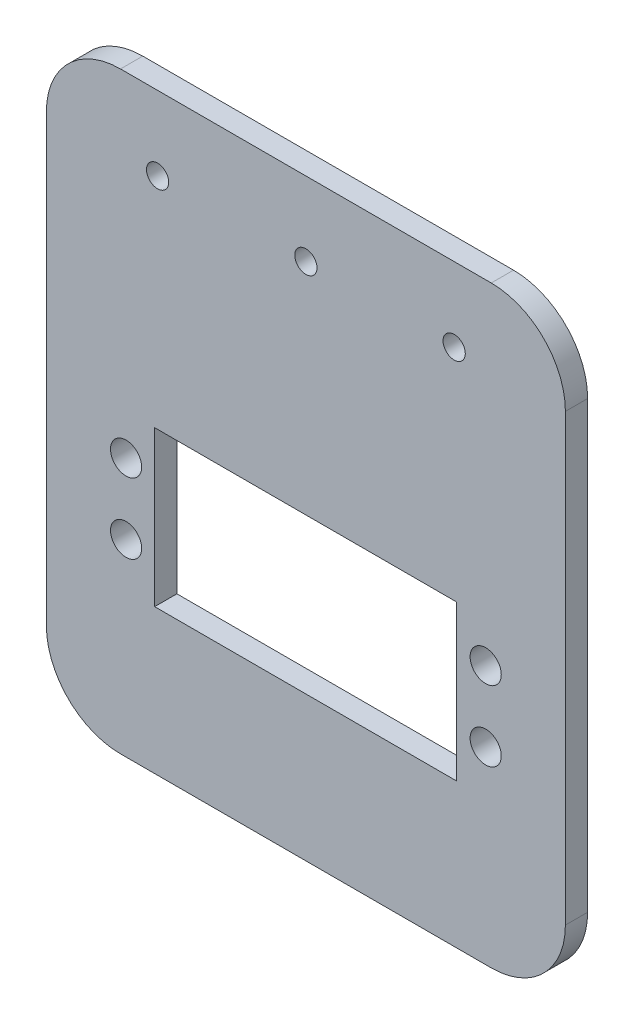
from build123d import *

# Parameters (mm, degrees)
SKETCH_1_W          = 70
SKETCH_1_H          = 80
EXTRUDE_1_DEPTH     = 3
SKETCH_4_R          = 2.1
SKETCH_4_W          = 40.676852231
SKETCH_4_H          = 20.906984827
CUT_EXTRUDE_3_DEPTH = 10
SKETCH_5_R          = 1.5
CUT_EXTRUDE_4_DEPTH = 10
FILLET_1_R          = 10


with BuildPart() as part:
    # 草图1 → 凸台-拉伸1 (new body)
    with BuildSketch(Plane.XY):
        Rectangle(SKETCH_1_W, SKETCH_1_H)
    extrude(amount=EXTRUDE_1_DEPTH)

    # 草图4 → 切除-拉伸3 (cut)
    with BuildSketch(Plane(origin=(0, 0, 0), x_dir=(-1, 0, 0), z_dir=(0, 0, -1))):
        with Locations((24.25, -14.575)):
            Circle(SKETCH_4_R)
        with Locations((24.25, -5.075)):
            Circle(SKETCH_4_R)
        with Locations((-24.25, -14.575)):
            Circle(SKETCH_4_R)
        with Locations((-24.25, -5.075)):
            Circle(SKETCH_4_R)
        with Locations((0.054839574, -10.049357678)):
            Rectangle(SKETCH_4_W, SKETCH_4_H)
    extrude(amount=-CUT_EXTRUDE_3_DEPTH, mode=Mode.SUBTRACT)

    # 草图5 → 切除-拉伸4 (cut)
    with BuildSketch(Plane.XY.offset(3)):
        with Locations((-20, 30)):
            Circle(SKETCH_5_R)
        with Locations((0, 30)):
            Circle(SKETCH_5_R)
        with Locations((20, 30)):
            Circle(SKETCH_5_R)
    extrude(amount=-CUT_EXTRUDE_4_DEPTH, mode=Mode.SUBTRACT)

    # 圆角1
    fillet_1_edges = [part.edges().sort_by_distance(p)[0] for p in [
        (35, -40, 1.5),
        (-35, -40, 1.5),
        (-35, 40, 1.5),
        (35, 40, 1.5),
    ]]
    fillet(fillet_1_edges, radius=FILLET_1_R)


solid = part.part
